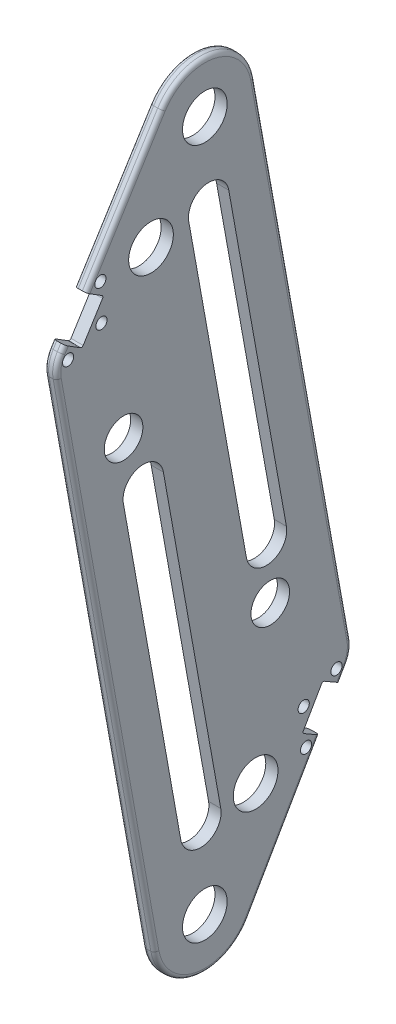
from build123d import *

# Parameters (mm, degrees)
SKETCH_2_R          = 9.5
SKETCH_2_R_2        = 11
EXTRUDE_1_DEPTH     = 6
CUT_EXTRUDE_1_DEPTH = 10
FILLET_1_R          = 25
SKETCH_4_R          = 2.75
CUT_EXTRUDE_2_DEPTH = 10
FILLET_2_R          = 15
FILLET_3_R          = 1
FILLET_4_R          = 2


with BuildPart() as part:
    # 草图2 → 凸台-拉伸1 (new body)
    with BuildSketch(Plane(origin=(0, 0, 0), x_dir=(0, 0, -1), z_dir=(1, 0, 0))):
        Polygon((13.119283448, 68.172240168), (-73.693623294, -70.757452058), (-12.535755442, -411.712565336), (72.916857811, -263.704297543), align=None)
        with Locations((-40, -117)):
            Circle(SKETCH_2_R, mode=Mode.SUBTRACT)
        with Locations((25, -296.698729811)):
            Circle(SKETCH_2_R_2, mode=Mode.SUBTRACT)
        with Locations((0, -340)):
            Circle(SKETCH_2_R_2, mode=Mode.SUBTRACT)
        with Locations((-26.495963212, -42.402404808)):
            Circle(SKETCH_2_R_2, mode=Mode.SUBTRACT)
        with Locations((32.2, -223.3)):
            Circle(SKETCH_2_R, mode=Mode.SUBTRACT)
        Circle(SKETCH_2_R_2, mode=Mode.SUBTRACT)
    extrude(amount=EXTRUDE_1_DEPTH)

    # 草图3 → 切除-拉伸1 (cut)
    with BuildSketch(Plane(origin=(6, 0, 0), x_dir=(0, 0, -1), z_dir=(1, 0, 0))):
        with BuildLine():
            Line((-20.40575236, -141.278289439), (7.842954525, -298.764830322))
            ThreePointArc((7.842954525, -298.764830322), (-0.2344101, -310.373283308), (-11.842863085, -302.295918683))
            Line((-11.842863085, -302.295918683), (-40.09156997, -144.8093778))
            ThreePointArc((-40.09156997, -144.8093778), (-32.014205345, -133.200924814), (-20.40575236, -141.278289439))
        make_face()
        with BuildLine():
            Line((11.783440235, -37.201240644), (40.155401092, -194.665623401))
            ThreePointArc((40.155401092, -194.665623401), (32.087124724, -206.280394877), (20.472353248, -198.212118508))
            Line((20.472353248, -198.212118508), (-7.89960761, -40.747735751))
            ThreePointArc((-7.89960761, -40.747735751), (0.168668759, -29.132964275), (11.783440235, -37.201240644))
        make_face()
    extrude(amount=-CUT_EXTRUDE_1_DEPTH, mode=Mode.SUBTRACT)

    # 圆角1
    fillet_1_edges = [part.edges().sort_by_distance(p)[0] for p in [
        (3, -411.712565336, 12.535755442),
        (3, 68.172240168, -13.119283448),
    ]]
    fillet(fillet_1_edges, radius=FILLET_1_R)

    # 草图4 → 切除-拉伸2 (cut)
    with BuildSketch(Plane(origin=(6, 0, 0), x_dir=(0, 0, -1), z_dir=(1, 0, 0))):
        with Locations((-51.405714098, -44.524740966)):
            Circle(SKETCH_4_R)
        with Locations((-67.303292025, -69.96618385)):
            Circle(SKETCH_4_R)
        with Locations((-50.8740221, -62.54465505)):
            Circle(SKETCH_4_R)
        with Locations((48.660254038, -275.717967697)):
            Circle(SKETCH_4_R)
        with Locations((49.820508076, -293.708348754)):
            Circle(SKETCH_4_R)
        with Locations((64.820508076, -267.72758664)):
            Circle(SKETCH_4_R)
        Polygon((-68.893936185, -63.076347048), (-58.2955509, -46.115385125), (-49.815069939, -51.414577767), (-60.413455223, -68.375539691), align=None)
        Polygon((47.990381057, -286.878221735), (57.990381057, -269.557713659), (66.650635095, -274.557713659), (56.650635095, -291.878221735), align=None)
    extrude(amount=-CUT_EXTRUDE_2_DEPTH, mode=Mode.SUBTRACT)

    # 圆角2
    fillet_2_edges = [part.edges().sort_by_distance(p)[0] for p in [
        (3, -263.704297543, -72.916857811),
        (3, -70.757452058, 73.693623294),
    ]]
    fillet(fillet_2_edges, radius=FILLET_2_R)

    # 圆角3
    fillet_3_edges = [part.edges().sort_by_distance(p)[0] for p in [
        (3, -286.878221735, -47.990381057),
        (3, -269.557713659, -57.990381057),
        (3, -51.414577767, 49.815069939),
        (3, -68.375539691, 60.413455223),
    ]]
    fillet(fillet_3_edges, radius=FILLET_3_R)

    # 圆角4
    fillet_4_edges = [part.edges().sort_by_distance(p)[0] for p in [
        (0, -210.431918375, 48.639907363),
        (6, -210.431918375, 48.639907363),
        (0, -126.933453974, -48.273462573),
        (0, -263.537032824, -71.957783708),
        (0, -70.961260301, 72.636795509),
        (6, -126.933453974, -48.273462573),
        (6, -263.537032824, -71.957783708),
        (6, -70.961260301, 72.636795509),
        (0, -322.189110868, -39.150635095),
        (6, -322.189110868, -39.150635095),
        (0, -16.43370176, 39.748376652),
        (0, 24.54954408, -4.724392605),
        (0, -364.626574291, 4.304862213),
        (6, -16.43370176, 39.748376652),
        (6, 24.54954408, -4.724392605),
        (6, -364.626574291, 4.304862213),
        (6, -271.508805911, -68.410922804),
        (0, -271.508805911, -68.410922804),
        (6, -64.464609056, 69.761418566),
        (0, -64.464609056, 69.761418566),
    ]]
    fillet(fillet_4_edges, radius=FILLET_4_R)


solid = part.part
